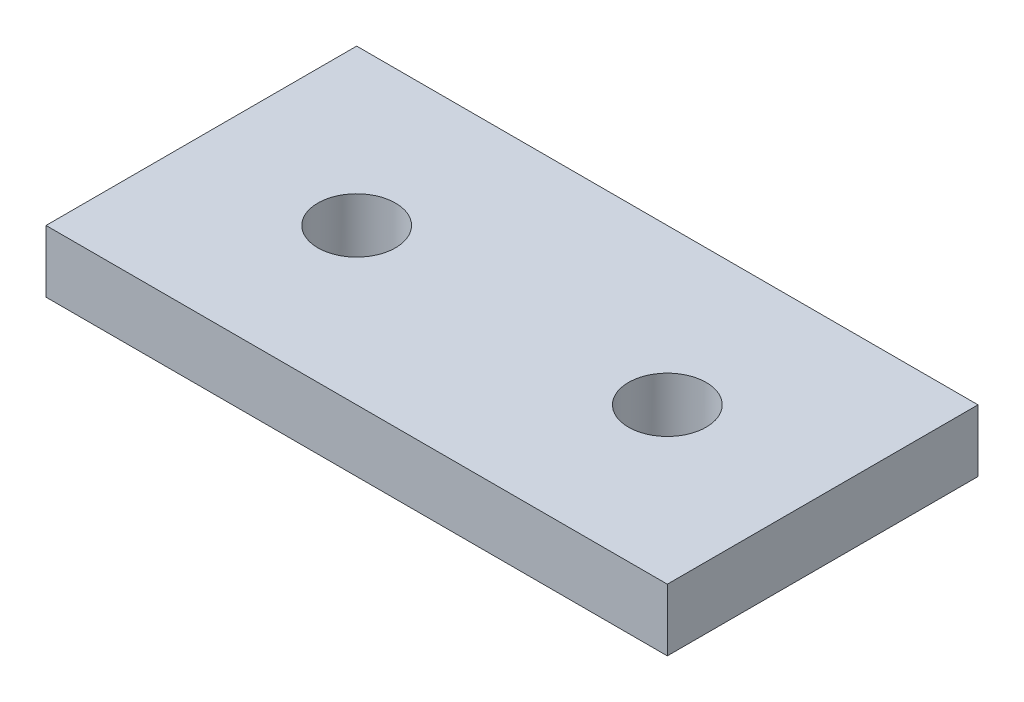
from build123d import *

# Parameters (mm, degrees)
BOSS_EXTRUDE1_DEPTH             = 5.08
F_1_4_0_25_DIAMETER_HOLE1_D     = 6.35
F_1_4_0_25_DIAMETER_HOLE1_DEPTH = 25.4
F_1_4_0_25_DIAMETER_HOLE1_TIP   = 1.907732465
CUT_EXTRUDE1_DEPTH              = 108.882743755
CUT_EXTRUDE1_DEPTH_BACK         = 108.882743755
SKETCH5_W                       = 25.4
SKETCH5_H                       = 5.08


with BuildPart() as part:
    # Sketch1 → Boss-Extrude1 (new body)
    with BuildSketch(Plane(origin=(0, 0, 0), x_dir=(1, 0, 0), z_dir=(0, 1, 0))):
        Polygon((0, 0), (0, 76.2), (25.4, 76.2), (25.4, 25.4), (76.2, 25.4), (76.2, 0), align=None)
    extrude(amount=BOSS_EXTRUDE1_DEPTH)

    # 1/4 (0.25) Diameter Hole1
    with Locations(Plane(origin=(0, 5.08, 0), x_dir=(1, 0, 0), z_dir=(0, 1, 0))):
        with Locations((12.7, 63.5), (12.7, 38.1), (12.7, 12.7), (38.1, 12.7), (63.5, 12.7)):
            Hole(F_1_4_0_25_DIAMETER_HOLE1_D / 2, depth=F_1_4_0_25_DIAMETER_HOLE1_DEPTH)
            with Locations((0, 0, -(F_1_4_0_25_DIAMETER_HOLE1_DEPTH + F_1_4_0_25_DIAMETER_HOLE1_TIP / 2))):  # 118° drill point
                Cone(0, F_1_4_0_25_DIAMETER_HOLE1_D / 2, F_1_4_0_25_DIAMETER_HOLE1_TIP, mode=Mode.SUBTRACT)

    # Sketch5 → Cut-Extrude1 (cut, two sides: drawn at the far end of the back side and taken through both)
    with BuildSketch(Plane(origin=(0, 0, -76.2), x_dir=(-1, 0, 0), z_dir=(0, 0, -1)).offset(-CUT_EXTRUDE1_DEPTH_BACK)):
        with Locations((-12.7, 2.54)):
            Rectangle(SKETCH5_W, SKETCH5_H)
    extrude(amount=CUT_EXTRUDE1_DEPTH + CUT_EXTRUDE1_DEPTH_BACK, mode=Mode.SUBTRACT)


solid = part.part
